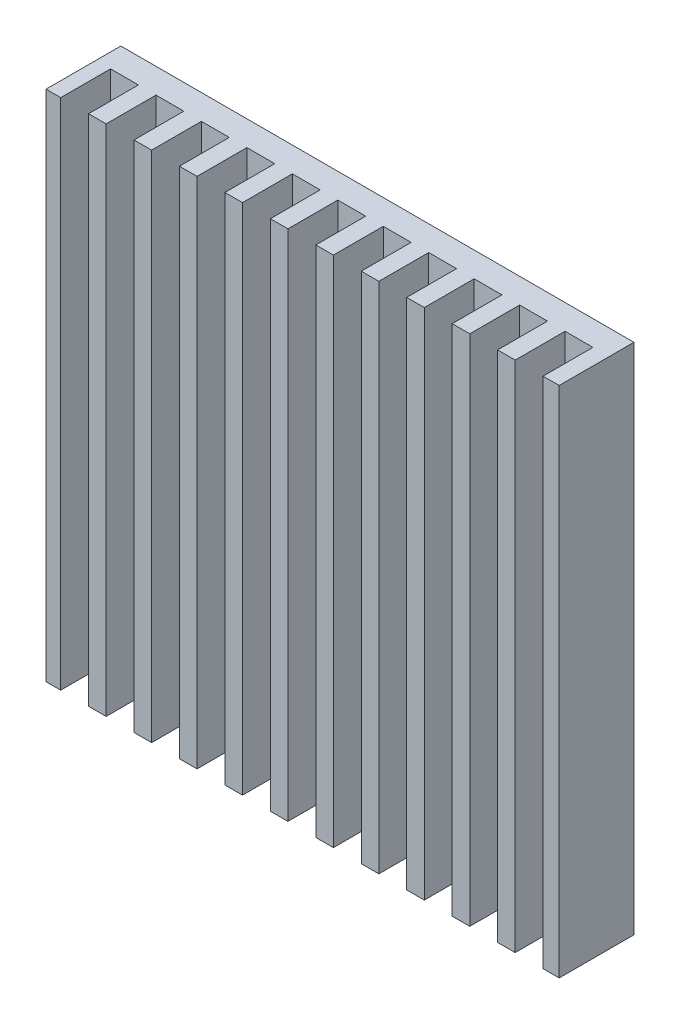
from build123d import *

# Parameters (mm, degrees)
SKETCH_1_W          = 35
SKETCH_1_H          = 35
EXTRUDE_1_DEPTH     = 5.1
SKETCH_2_W          = 1.9
SKETCH_2_H          = 3.4
CUT_EXTRUDE_1_DEPTH = 50.759521702


with BuildPart() as part:
    # 草图1 → 凸台-拉伸1 (new body)
    with BuildSketch(Plane.XY):
        with Locations((17.5, -17.5)):
            Rectangle(SKETCH_1_W, SKETCH_1_H)
    extrude(amount=EXTRUDE_1_DEPTH)

    # 草图2 → 切除-拉伸1 (cut, through all)
    with BuildSketch(Plane.XZ.offset(35)):
        with Locations((1.95, 3.4)):
            Rectangle(SKETCH_2_W, SKETCH_2_H)
        with Locations((5.05, 3.4)):
            Rectangle(SKETCH_2_W, SKETCH_2_H)
        with Locations((8.15, 3.4)):
            Rectangle(SKETCH_2_W, SKETCH_2_H)
        with Locations((11.25, 3.4)):
            Rectangle(SKETCH_2_W, SKETCH_2_H)
        with Locations((14.35, 3.4)):
            Rectangle(SKETCH_2_W, SKETCH_2_H)
        with Locations((17.45, 3.4)):
            Rectangle(SKETCH_2_W, SKETCH_2_H)
        with Locations((20.55, 3.4)):
            Rectangle(SKETCH_2_W, SKETCH_2_H)
        with Locations((23.65, 3.4)):
            Rectangle(SKETCH_2_W, SKETCH_2_H)
        with Locations((26.75, 3.4)):
            Rectangle(SKETCH_2_W, SKETCH_2_H)
        with Locations((29.85, 3.4)):
            Rectangle(SKETCH_2_W, SKETCH_2_H)
        with Locations((32.95, 3.4)):
            Rectangle(SKETCH_2_W, SKETCH_2_H)
    extrude(amount=-CUT_EXTRUDE_1_DEPTH, mode=Mode.SUBTRACT)


solid = part.part
